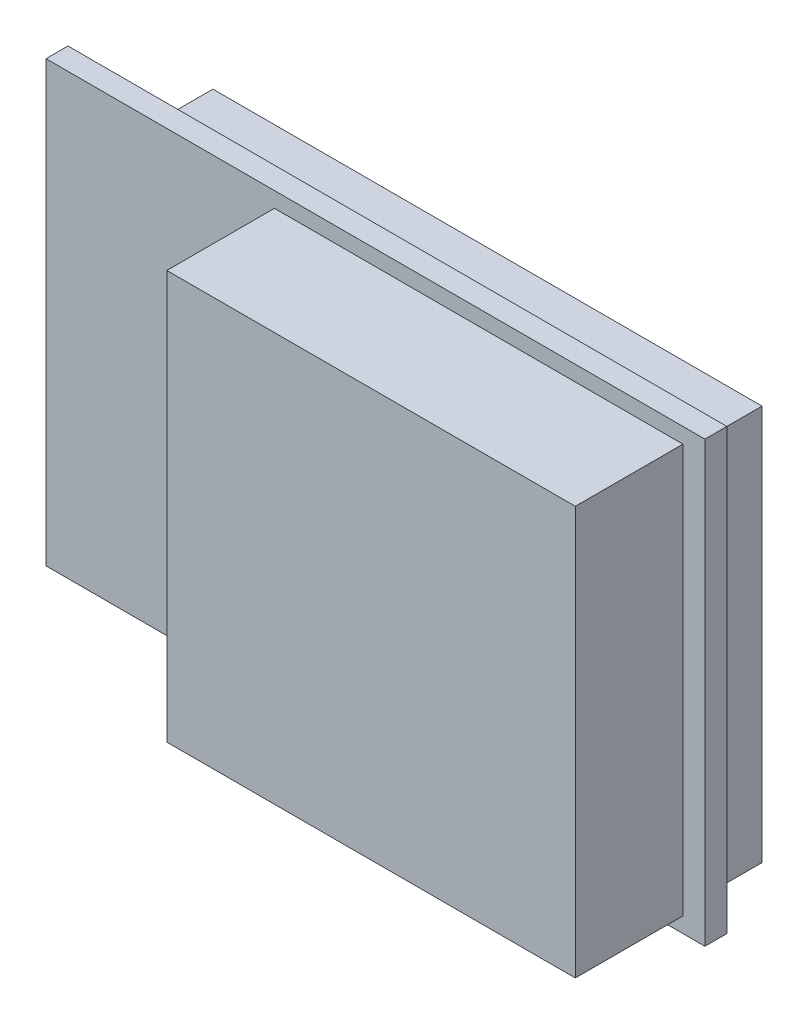
from build123d import *

# Parameters (mm, degrees)
SKETCH1_W           = 30
SKETCH1_H           = 20
BOSS_EXTRUDE1_DEPTH = 1
SKETCH2_W           = 3
SKETCH2_H           = 12.8
BOSS_EXTRUDE2_DEPTH = 2.2
SKETCH3_W           = 1
SKETCH3_H           = 1
BOSS_EXTRUDE3_DEPTH = 5
LPATTERN1_COUNT     = 6
LPATTERN1_PITCH     = 2
SKETCH4_W           = 25
SKETCH4_H           = 18
BOSS_EXTRUDE4_DEPTH = 2.6
SKETCH5_W           = 18.6
SKETCH5_H           = 18.6
BOSS_EXTRUDE5_DEPTH = 4.9


with BuildPart() as part:
    # Sketch1 → Boss-Extrude1 (new body)
    with BuildSketch(Plane.XY):
        Rectangle(SKETCH1_W, SKETCH1_H)
    extrude(amount=BOSS_EXTRUDE1_DEPTH)

    # Sketch2 → Boss-Extrude2 (add)
    with BuildSketch(Plane(origin=(0, 0, 0), x_dir=(-1, 0, 0), z_dir=(0, 0, -1))):
        with Locations((13.5, -3.6)):
            Rectangle(SKETCH2_W, SKETCH2_H)
    extrude(amount=BOSS_EXTRUDE2_DEPTH)

    # Sketch3 → Boss-Extrude3 (add)
    with BuildSketch(Plane(origin=(0, 0, -2.2), x_dir=(-1, 0, 0), z_dir=(0, 0, -1))):
        with Locations((13.5, -8.6)):
            Rectangle(SKETCH3_W, SKETCH3_H)
    boss_extrude3 = extrude(amount=BOSS_EXTRUDE3_DEPTH)

    # LPattern1: Boss-Extrude3 ×6
    with Locations(*[(0, i * LPATTERN1_PITCH, 0) for i in range(1, LPATTERN1_COUNT)]):
        add(boss_extrude3)

    # Sketch4 → Boss-Extrude4 (add)
    with BuildSketch(Plane(origin=(0, 0, 0), x_dir=(-1, 0, 0), z_dir=(0, 0, -1))):
        with Locations((-1.5, 0)):
            Rectangle(SKETCH4_W, SKETCH4_H)
    extrude(amount=BOSS_EXTRUDE4_DEPTH)

    # Sketch5 → Boss-Extrude5 (add)
    with BuildSketch(Plane.XY.offset(1)):
        with Locations((4.7, 0)):
            Rectangle(SKETCH5_W, SKETCH5_H)
    extrude(amount=BOSS_EXTRUDE5_DEPTH)


solid = part.part
